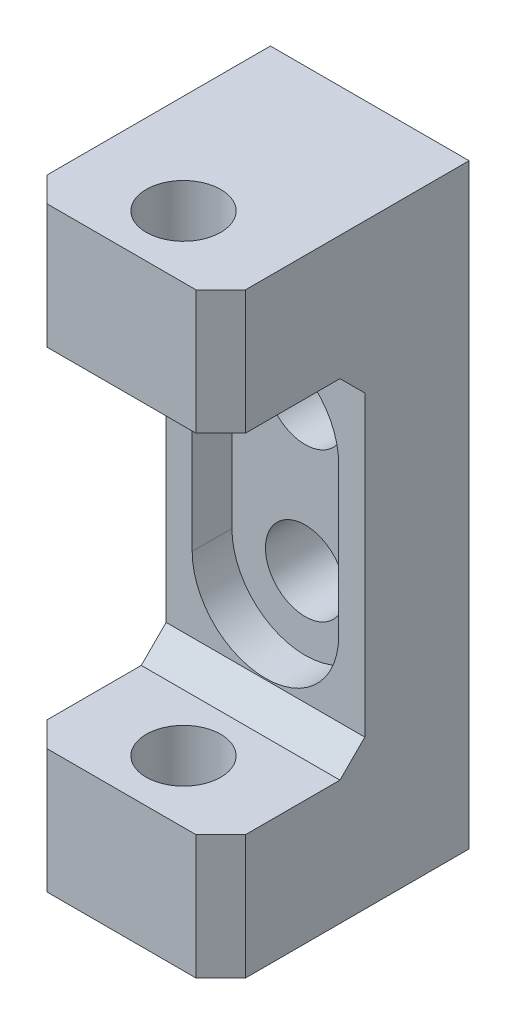
from build123d import *

# Parameters (mm, degrees)
SKETCH_2_W                   = 8
SKETCH_2_H                   = 24
EXTRUDE_1_DEPTH              = 10
SKETCH_3_W                   = 9.180468112
SKETCH_3_H                   = 14
CUT_EXTRUDE_1_DEPTH          = 40
CHAMFER_1_SIZE               = 1
HOLE_WIZARD_M3_1_D           = 3.2
HOLE_WIZARD_M3_1_CBORE_D     = 5.9
HOLE_WIZARD_M3_1_CBORE_DEPTH = 1.6
CUT_EXTRUDE_2_DEPTH          = 1.6
MM_2_D                       = 3
MM_2_DEPTH                   = 24
MM_2_TIP                     = 0.901290929
CHAMFER_2_SIZE               = 1


with BuildPart() as part:
    # 草图2 → 凸台-拉伸1 (new body)
    with BuildSketch(Plane.XY):
        with Locations((100, 93)):
            Rectangle(SKETCH_2_W, SKETCH_2_H)
    extrude(amount=EXTRUDE_1_DEPTH)

    # 草图3 → 切除-拉伸1 (cut)
    with BuildSketch(Plane.ZY.offset(-96)):
        with Locations((8.790234056, 93)):
            Rectangle(SKETCH_3_W, SKETCH_3_H)
    extrude(amount=-CUT_EXTRUDE_1_DEPTH, mode=Mode.SUBTRACT)

    # 倒角1
    chamfer_1_edges = [part.edges().sort_by_distance(p)[0] for p in [
        (100, 86, 4.2),
        (100, 100, 4.2),
    ]]
    chamfer(chamfer_1_edges, length=CHAMFER_1_SIZE)

    # M3 六角头螺栓的柱形沉头孔1 (through all)
    with Locations(Plane(origin=(124.363861944, -131.010130877, 4.2), x_dir=(0, 1, 0), z_dir=(0, 0, 1))):
        with Locations((221.010130877, 24.363861944), (227.010130877, 24.363861944)):
            CounterBoreHole(HOLE_WIZARD_M3_1_D / 2, HOLE_WIZARD_M3_1_CBORE_D / 2, HOLE_WIZARD_M3_1_CBORE_DEPTH)

    # 草图11 → 切除-拉伸2 (cut)
    with BuildSketch(Plane.XY.offset(4.2)):
        with BuildLine():
            Line((97.05, 90), (97.05, 96))
            ThreePointArc((97.05, 96), (100, 98.95), (102.95, 96))
            Line((102.95, 96), (102.95, 90))
            ThreePointArc((102.95, 90), (100, 87.05), (97.05, 90))
        make_face()
    extrude(amount=-CUT_EXTRUDE_2_DEPTH, mode=Mode.SUBTRACT)

    # 大小mm 暗销孔2
    with Locations(Plane(origin=(124.363861944, 105, -5), x_dir=(-1, 0, 0), z_dir=(0, 1, 0))):
        with Locations((24.363861944, 12.5)):
            Hole(MM_2_D / 2, depth=MM_2_DEPTH)
            with Locations((0, 0, -(MM_2_DEPTH + MM_2_TIP / 2))):  # 118° drill point
                Cone(0, MM_2_D / 2, MM_2_TIP, mode=Mode.SUBTRACT)

    # 倒角2
    chamfer_2_edges = [part.edges().sort_by_distance(p)[0] for p in [
        (96, 102.5, 10),
        (104, 102.5, 10),
        (96, 83.5, 10),
        (104, 83.5, 10),
    ]]
    chamfer(chamfer_2_edges, length=CHAMFER_2_SIZE)


solid = part.part
